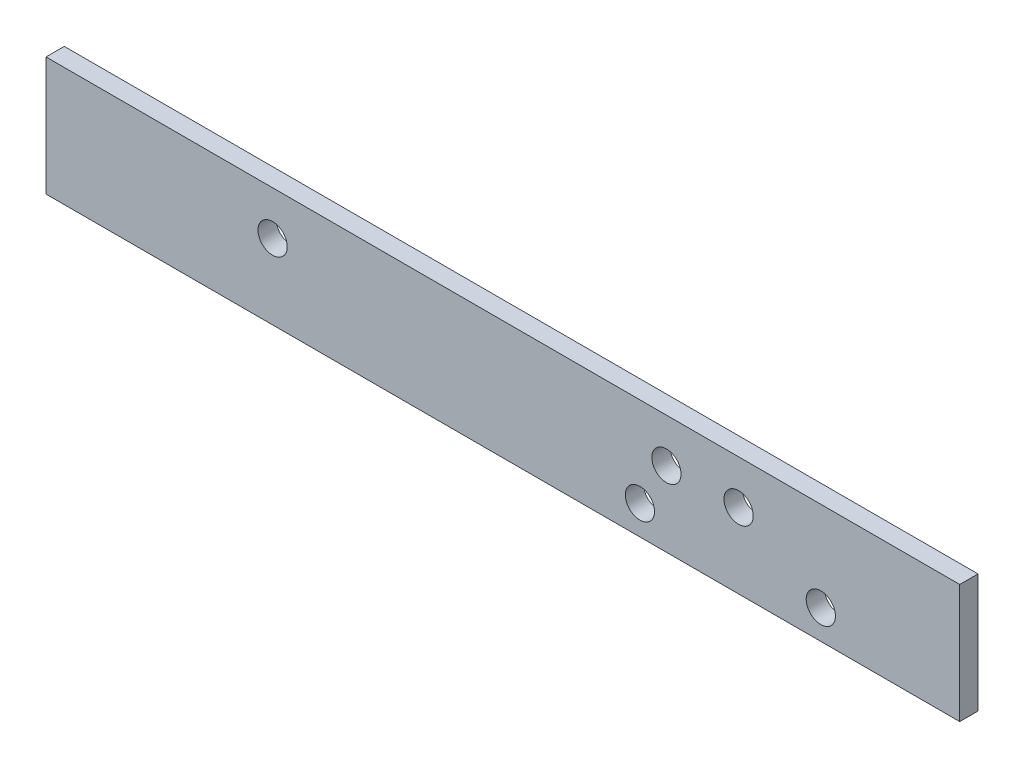
from build123d import *

# Parameters (mm, degrees)
SKETCH1_W           = 100
SKETCH1_H           = 13
SKETCH1_R           = 1.6
BOSS_EXTRUDE1_DEPTH = 2


with BuildPart() as part:
    # Sketch1 → Boss-Extrude1 (new body)
    with BuildSketch(Plane.XY):
        with Locations((50, 6.5)):
            Rectangle(SKETCH1_W, SKETCH1_H)
        with Locations((84.8, 3.2)):
            Circle(SKETCH1_R, mode=Mode.SUBTRACT)
        with Locations((75.8, 8.2)):
            Circle(SKETCH1_R, mode=Mode.SUBTRACT)
        with Locations((67.9, 8.2)):
            Circle(SKETCH1_R, mode=Mode.SUBTRACT)
        with Locations((65, 3.2)):
            Circle(SKETCH1_R, mode=Mode.SUBTRACT)
        with Locations((24.8, 8.2)):
            Circle(SKETCH1_R, mode=Mode.SUBTRACT)
    extrude(amount=BOSS_EXTRUDE1_DEPTH)


solid = part.part
